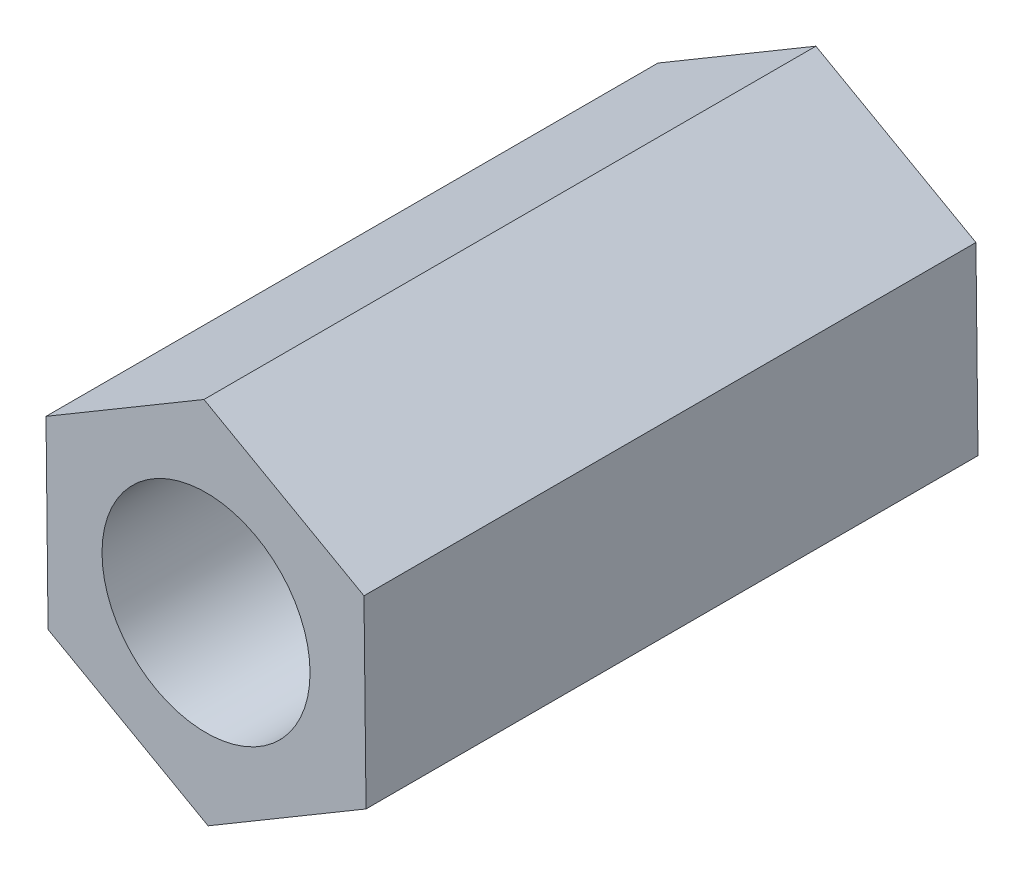
from build123d import *

# Parameters (mm, degrees)
BOSS_EXTRUDE1_DEPTH     = 25
CUT_EXTRUDE1_DEPTH      = 32.952398564
CUT_EXTRUDE1_DEPTH_BACK = 32.952398564
SKETCH1_R               = 8.5


with BuildPart() as part:
    # Sketch2 → Boss-Extrude1 (new, symmetric)
    with BuildSketch(Plane.XY):
        Polygon((12.905756416, 7.646574177), (-0.169249281, 15), (-13.075005697, 7.353425823), (-12.905756416, -7.646574177), (0.169249281, -15), (13.075005697, -7.353425823), align=None)
    extrude(amount=BOSS_EXTRUDE1_DEPTH, both=True)

    # Sketch1 → Cut-Extrude1 (cut, two sides: drawn at the far end of the back side and taken through both)
    with BuildSketch(Plane.XY.offset(-CUT_EXTRUDE1_DEPTH_BACK)):
        Circle(SKETCH1_R)
    extrude(amount=CUT_EXTRUDE1_DEPTH + CUT_EXTRUDE1_DEPTH_BACK, mode=Mode.SUBTRACT)


solid = part.part
